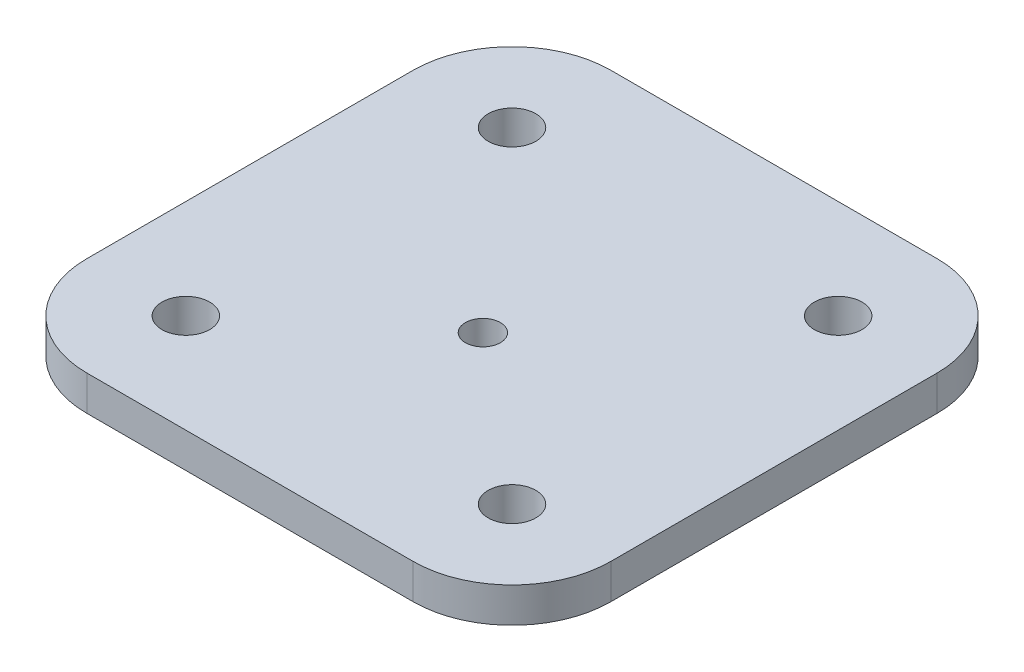
from build123d import *

# Parameters (mm, degrees)
SKETCH_1_R          = 2.05
EXTRUDE_1_DEPTH     = 3
SKETCH_2_R          = 1.5
CUT_EXTRUDE_1_DEPTH = 3


with BuildPart() as part:
    # Эскиз1 → Бобышка-Вытянуть1 (new body)
    with BuildSketch(Plane(origin=(0, 0, 0), x_dir=(1, 0, 0), z_dir=(0, 1, 0))):
        with BuildLine():
            Line((-14, -22.5), (14, -22.5))
            ThreePointArc((14, -22.5), (20.01040764, -20.01040764), (22.5, -14))
            Line((22.5, -14), (22.5, 14))
            ThreePointArc((22.5, 14), (20.01040764, 20.01040764), (14, 22.5))
            Line((14, 22.5), (-14, 22.5))
            ThreePointArc((-14, 22.5), (-20.01040764, 20.01040764), (-22.5, 14))
            Line((-22.5, 14), (-22.5, -14))
            ThreePointArc((-22.5, -14), (-20.01040764, -20.01040764), (-14, -22.5))
        make_face()
        with Locations(Location((14, 14, 0), (0, 0, 270))):
            Circle(SKETCH_1_R, mode=Mode.SUBTRACT)
        with Locations(Location((14, -14, 0), (0, 0, 270))):
            Circle(SKETCH_1_R, mode=Mode.SUBTRACT)
        with Locations(Location((-14, -14, 0), (0, 0, 270))):
            Circle(SKETCH_1_R, mode=Mode.SUBTRACT)
        with Locations(Location((-14, 14, 0), (0, 0, 270))):
            Circle(SKETCH_1_R, mode=Mode.SUBTRACT)
    extrude(amount=EXTRUDE_1_DEPTH)

    # Эскиз2 → Вырез-Вытянуть1 (cut)
    with BuildSketch(Plane.XZ):
        with Locations(Location((0, 2.5, 0), (0, 0, 270))):
            Circle(SKETCH_2_R)
    extrude(amount=-CUT_EXTRUDE_1_DEPTH, mode=Mode.SUBTRACT)


solid = part.part
